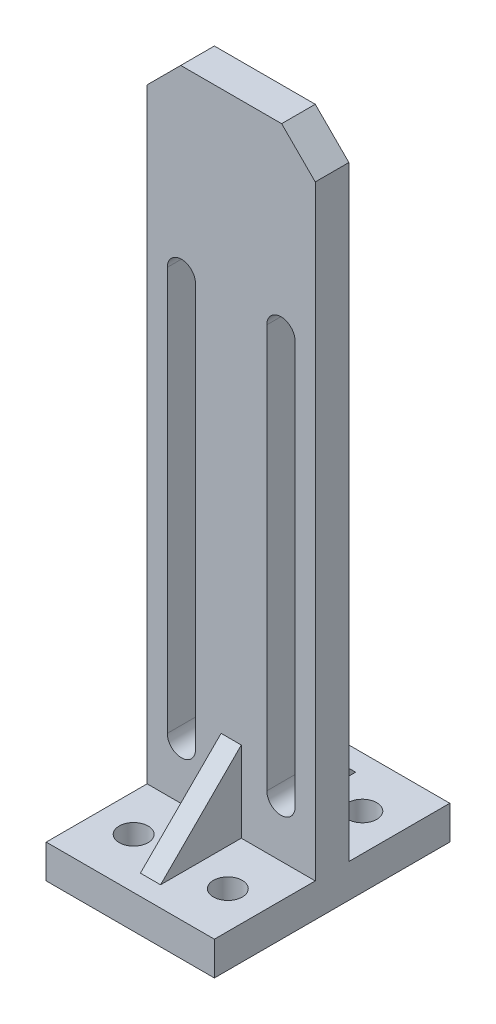
from build123d import *

# Parameters (mm, degrees)
BOSS_EXTRUDE1_DEPTH = 2.5
SKETCH2_W           = 15
SKETCH2_H           = 5
BOSS_EXTRUDE2_DEPTH = 12.5
BOSS_EXTRUDE3_DEPTH = 1.5
SKETCH6_R           = 2.15
CUT_EXTRUDE1_DEPTH  = 5


with BuildPart() as part:
    # Sketch1 → Boss-Extrude1 (new, symmetric)
    with BuildSketch(Plane.XY):
        Polygon((-12.5, 45), (-7.5, 50), (7.5, 50), (12.5, 45), (12.5, -50), (-12.5, -50), align=None)
        with BuildLine():
            Line((9.5, 23), (9.5, -37))
            ThreePointArc((9.5, -37), (7.4, -39.1), (5.3, -37))
            Line((5.3, -37), (5.3, 23))
            ThreePointArc((5.3, 23), (7.4, 25.1), (9.5, 23))
        make_face(mode=Mode.SUBTRACT)
        with BuildLine():
            Line((-9.5, 23), (-9.5, -37))
            ThreePointArc((-9.5, -37), (-7.4, -39.1), (-5.3, -37))
            Line((-5.3, -37), (-5.3, 23))
            ThreePointArc((-5.3, 23), (-7.4, 25.1), (-9.5, 23))
        make_face(mode=Mode.SUBTRACT)
    extrude(amount=BOSS_EXTRUDE1_DEPTH, both=True)

    # Sketch2 → Boss-Extrude2 (add, symmetric)
    with BuildSketch(Plane(origin=(0, 0, 0), x_dir=(0, 0, -1), z_dir=(1, 0, 0))):
        with Locations((10, -47.5)):
            Rectangle(SKETCH2_W, SKETCH2_H)
        with Locations((-10, -47.5)):
            Rectangle(SKETCH2_W, SKETCH2_H)
    extrude(amount=BOSS_EXTRUDE2_DEPTH, both=True)

    # Sketch5 → Boss-Extrude3 (add, symmetric)
    with BuildSketch(Plane(origin=(0, 0, 0), x_dir=(0, 0, -1), z_dir=(1, 0, 0))):
        Polygon((-14.5, -45), (-2.5, -33), (-2.5, -45), align=None)
        Polygon((2.5, -33), (2.5, -45), (14.5, -45), align=None)
    extrude(amount=BOSS_EXTRUDE3_DEPTH, both=True)

    # Sketch6 → Cut-Extrude1 (cut)
    with BuildSketch(Plane(origin=(0, -45, 0), x_dir=(1, 0, 0), z_dir=(0, 1, 0))):
        with Locations(Location((-7, 10, 0), (0, 0, 270))):
            Circle(SKETCH6_R)
        with Locations(Location((7, 10, 0), (0, 0, 270))):
            Circle(SKETCH6_R)
        with Locations(Location((7, -10, 0), (0, 0, 270))):
            Circle(SKETCH6_R)
        with Locations(Location((-7, -10, 0), (0, 0, 270))):
            Circle(SKETCH6_R)
    extrude(amount=-CUT_EXTRUDE1_DEPTH, mode=Mode.SUBTRACT)


solid = part.part
